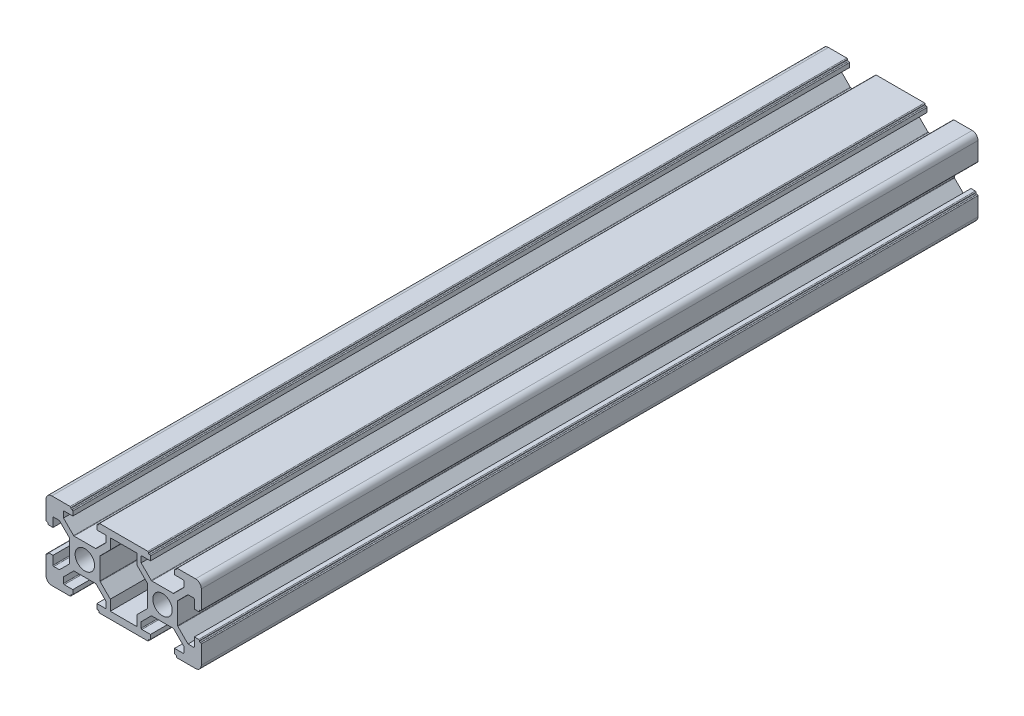
from build123d import *

# Parameters (mm, degrees)
BOSS_EXTRUDE1_DEPTH = 200
SKETCH2_R           = 2.5
CUT_EXTRUDE1_DEPTH  = 203.484567313
SKETCH3_R           = 1.5
CUT_EXTRUDE2_DEPTH  = 10
CUT_EXTRUDE3_DEPTH  = 1


with BuildPart() as part:
    # Sketch1 → Boss-Extrude1 (new body)
    with BuildSketch(Plane.XY):
        with BuildLine():
            Line((-8.5, 10), (-3.8, 10))
            ThreePointArc((-3.8, 10), (-3.658578644, 9.941421356), (-3.6, 9.8))
            Line((-3.6, 9.8), (-3.6, 9.7))
            ThreePointArc((-3.6, 9.7), (-3.541421356, 9.558578644), (-3.4, 9.5))
            Line((-3.4, 9.5), (-3.3, 9.5))
            ThreePointArc((-3.3, 9.5), (-3.158578644, 9.441421356), (-3.1, 9.3))
            Line((-3.1, 9.3), (-3.1, 8.2))
            Line((-3.1, 8.2), (-5.3, 8.2))
            ThreePointArc((-5.3, 8.2), (-5.441421356, 8.141421356), (-5.5, 8))
            Line((-5.5, 8), (-5.5, 6.560660172))
            Line((-5.5, 6.560660172), (-2.897918472, 3.958578644))
            ThreePointArc((-2.897918472, 3.958578644), (-2.833033802, 3.915224093), (-2.756497116, 3.9))
            Line((-2.756497116, 3.9), (2.756497116, 3.9))
            ThreePointArc((2.756497116, 3.9), (2.833033802, 3.915224093), (2.897918472, 3.958578644))
            Line((2.897918472, 3.958578644), (5.5, 6.560660172))
            Line((5.5, 6.560660172), (5.5, 8))
            ThreePointArc((5.5, 8), (5.441421356, 8.141421356), (5.3, 8.2))
            Line((5.3, 8.2), (3.1, 8.2))
            Line((3.1, 8.2), (3.1, 9.3))
            ThreePointArc((3.1, 9.3), (3.158578644, 9.441421356), (3.3, 9.5))
            Line((3.3, 9.5), (3.4, 9.5))
            ThreePointArc((3.4, 9.5), (3.541421356, 9.558578644), (3.6, 9.7))
            Line((3.6, 9.7), (3.6, 9.8))
            ThreePointArc((3.6, 9.8), (3.658578644, 9.941421356), (3.8, 10))
            Line((3.8, 10), (8.5, 10))
            Line((8.5, 10), (11.5, 10))
            Line((11.5, 10), (16.2, 10))
            ThreePointArc((16.2, 10), (16.341421356, 9.941421356), (16.4, 9.8))
            Line((16.4, 9.8), (16.4, 9.7))
            ThreePointArc((16.4, 9.7), (16.458578644, 9.558578644), (16.6, 9.5))
            Line((16.6, 9.5), (16.7, 9.5))
            ThreePointArc((16.7, 9.5), (16.841421356, 9.441421356), (16.9, 9.3))
            Line((16.9, 9.3), (16.9, 8.2))
            Line((16.9, 8.2), (14.7, 8.2))
            ThreePointArc((14.7, 8.2), (14.558578644, 8.141421356), (14.5, 8))
            Line((14.5, 8), (14.5, 6.560660172))
            Line((14.5, 6.560660172), (17.102081528, 3.958578644))
            ThreePointArc((17.102081528, 3.958578644), (17.166966198, 3.915224093), (17.243502884, 3.9))
            Line((17.243502884, 3.9), (22.756497116, 3.9))
            ThreePointArc((22.756497116, 3.9), (22.833033802, 3.915224093), (22.897918472, 3.958578644))
            Line((22.897918472, 3.958578644), (25.5, 6.560660172))
            Line((25.5, 6.560660172), (25.5, 8))
            ThreePointArc((25.5, 8), (25.441421356, 8.141421356), (25.3, 8.2))
            Line((25.3, 8.2), (23.1, 8.2))
            Line((23.1, 8.2), (23.1, 9.3))
            ThreePointArc((23.1, 9.3), (23.158578644, 9.441421356), (23.3, 9.5))
            Line((23.3, 9.5), (23.4, 9.5))
            ThreePointArc((23.4, 9.5), (23.541421356, 9.558578644), (23.6, 9.7))
            Line((23.6, 9.7), (23.6, 9.8))
            ThreePointArc((23.6, 9.8), (23.658578644, 9.941421356), (23.8, 10))
            Line((23.8, 10), (28.5, 10))
            ThreePointArc((28.5, 10), (29.560660172, 9.560660172), (30, 8.5))
            Line((30, 8.5), (30, 3.8))
            ThreePointArc((30, 3.8), (29.941421356, 3.658578644), (29.8, 3.6))
            Line((29.8, 3.6), (29.7, 3.6))
            ThreePointArc((29.7, 3.6), (29.558578644, 3.541421356), (29.5, 3.4))
            Line((29.5, 3.4), (29.5, 3.3))
            ThreePointArc((29.5, 3.3), (29.441421356, 3.158578644), (29.3, 3.1))
            Line((29.3, 3.1), (28.2, 3.1))
            Line((28.2, 3.1), (28.2, 5.3))
            ThreePointArc((28.2, 5.3), (28.141421356, 5.441421356), (28, 5.5))
            Line((28, 5.5), (26.560660172, 5.5))
            Line((26.560660172, 5.5), (23.958578644, 2.897918472))
            ThreePointArc((23.958578644, 2.897918472), (23.915224093, 2.833033802), (23.9, 2.756497116))
            Line((23.9, 2.756497116), (23.9, -2.756497116))
            ThreePointArc((23.9, -2.756497116), (23.915224093, -2.833033802), (23.958578644, -2.897918472))
            Line((23.958578644, -2.897918472), (26.560660172, -5.5))
            Line((26.560660172, -5.5), (28, -5.5))
            ThreePointArc((28, -5.5), (28.141421356, -5.441421356), (28.2, -5.3))
            Line((28.2, -5.3), (28.2, -3.1))
            Line((28.2, -3.1), (29.3, -3.1))
            ThreePointArc((29.3, -3.1), (29.441421356, -3.158578644), (29.5, -3.3))
            Line((29.5, -3.3), (29.5, -3.4))
            ThreePointArc((29.5, -3.4), (29.558578644, -3.541421356), (29.7, -3.6))
            Line((29.7, -3.6), (29.8, -3.6))
            ThreePointArc((29.8, -3.6), (29.941421356, -3.658578644), (30, -3.8))
            Line((30, -3.8), (30, -8.5))
            ThreePointArc((30, -8.5), (29.560660172, -9.560660172), (28.5, -10))
            Line((28.5, -10), (23.8, -10))
            ThreePointArc((23.8, -10), (23.658578644, -9.941421356), (23.6, -9.8))
            Line((23.6, -9.8), (23.6, -9.7))
            ThreePointArc((23.6, -9.7), (23.541421356, -9.558578644), (23.4, -9.5))
            Line((23.4, -9.5), (23.3, -9.5))
            ThreePointArc((23.3, -9.5), (23.158578644, -9.441421356), (23.1, -9.3))
            Line((23.1, -9.3), (23.1, -8.2))
            Line((23.1, -8.2), (25.3, -8.2))
            ThreePointArc((25.3, -8.2), (25.441421356, -8.141421356), (25.5, -8))
            Line((25.5, -8), (25.5, -6.560660172))
            Line((25.5, -6.560660172), (22.897918472, -3.958578644))
            ThreePointArc((22.897918472, -3.958578644), (22.833033802, -3.915224093), (22.756497116, -3.9))
            Line((22.756497116, -3.9), (17.243502884, -3.9))
            ThreePointArc((17.243502884, -3.9), (17.166966198, -3.915224093), (17.102081528, -3.958578644))
            Line((17.102081528, -3.958578644), (14.5, -6.560660172))
            Line((14.5, -6.560660172), (14.5, -8))
            ThreePointArc((14.5, -8), (14.558578644, -8.141421356), (14.7, -8.2))
            Line((14.7, -8.2), (16.9, -8.2))
            Line((16.9, -8.2), (16.9, -9.3))
            ThreePointArc((16.9, -9.3), (16.841421356, -9.441421356), (16.7, -9.5))
            Line((16.7, -9.5), (16.6, -9.5))
            ThreePointArc((16.6, -9.5), (16.458578644, -9.558578644), (16.4, -9.7))
            Line((16.4, -9.7), (16.4, -9.8))
            ThreePointArc((16.4, -9.8), (16.341421356, -9.941421356), (16.2, -10))
            Line((16.2, -10), (11.5, -10))
            Line((11.5, -10), (8.5, -10))
            Line((8.5, -10), (3.8, -10))
            ThreePointArc((3.8, -10), (3.658578644, -9.941421356), (3.6, -9.8))
            Line((3.6, -9.8), (3.6, -9.7))
            ThreePointArc((3.6, -9.7), (3.541421356, -9.558578644), (3.4, -9.5))
            Line((3.4, -9.5), (3.3, -9.5))
            ThreePointArc((3.3, -9.5), (3.158578644, -9.441421356), (3.1, -9.3))
            Line((3.1, -9.3), (3.1, -8.2))
            Line((3.1, -8.2), (5.3, -8.2))
            ThreePointArc((5.3, -8.2), (5.441421356, -8.141421356), (5.5, -8))
            Line((5.5, -8), (5.5, -6.560660172))
            Line((5.5, -6.560660172), (2.897918472, -3.958578644))
            ThreePointArc((2.897918472, -3.958578644), (2.833033802, -3.915224093), (2.756497116, -3.9))
            Line((2.756497116, -3.9), (-2.756497116, -3.9))
            ThreePointArc((-2.756497116, -3.9), (-2.833033802, -3.915224093), (-2.897918472, -3.958578644))
            Line((-2.897918472, -3.958578644), (-5.5, -6.560660172))
            Line((-5.5, -6.560660172), (-5.5, -8))
            ThreePointArc((-5.5, -8), (-5.441421356, -8.141421356), (-5.3, -8.2))
            Line((-5.3, -8.2), (-3.1, -8.2))
            Line((-3.1, -8.2), (-3.1, -9.3))
            ThreePointArc((-3.1, -9.3), (-3.158578644, -9.441421356), (-3.3, -9.5))
            Line((-3.3, -9.5), (-3.4, -9.5))
            ThreePointArc((-3.4, -9.5), (-3.541421356, -9.558578644), (-3.6, -9.7))
            Line((-3.6, -9.7), (-3.6, -9.8))
            ThreePointArc((-3.6, -9.8), (-3.658578644, -9.941421356), (-3.8, -10))
            Line((-3.8, -10), (-8.5, -10))
            ThreePointArc((-8.5, -10), (-9.560660172, -9.560660172), (-10, -8.5))
            Line((-10, -8.5), (-10, -3.8))
            ThreePointArc((-10, -3.8), (-9.941421356, -3.658578644), (-9.8, -3.6))
            Line((-9.8, -3.6), (-9.7, -3.6))
            ThreePointArc((-9.7, -3.6), (-9.558578644, -3.541421356), (-9.5, -3.4))
            Line((-9.5, -3.4), (-9.5, -3.3))
            ThreePointArc((-9.5, -3.3), (-9.441421356, -3.158578644), (-9.3, -3.1))
            Line((-9.3, -3.1), (-8.2, -3.1))
            Line((-8.2, -3.1), (-8.2, -5.3))
            ThreePointArc((-8.2, -5.3), (-8.141421356, -5.441421356), (-8, -5.5))
            Line((-8, -5.5), (-6.560660172, -5.5))
            Line((-6.560660172, -5.5), (-3.958578644, -2.897918472))
            ThreePointArc((-3.958578644, -2.897918472), (-3.915224093, -2.833033802), (-3.9, -2.756497116))
            Line((-3.9, -2.756497116), (-3.9, 2.756497116))
            ThreePointArc((-3.9, 2.756497116), (-3.915224093, 2.833033802), (-3.958578644, 2.897918472))
            Line((-3.958578644, 2.897918472), (-6.560660172, 5.5))
            Line((-6.560660172, 5.5), (-8, 5.5))
            ThreePointArc((-8, 5.5), (-8.141421356, 5.441421356), (-8.2, 5.3))
            Line((-8.2, 5.3), (-8.2, 3.1))
            Line((-8.2, 3.1), (-9.3, 3.1))
            ThreePointArc((-9.3, 3.1), (-9.441421356, 3.158578644), (-9.5, 3.3))
            Line((-9.5, 3.3), (-9.5, 3.4))
            ThreePointArc((-9.5, 3.4), (-9.558578644, 3.541421356), (-9.7, 3.6))
            Line((-9.7, 3.6), (-9.8, 3.6))
            ThreePointArc((-9.8, 3.6), (-9.941421356, 3.658578644), (-10, 3.8))
            Line((-10, 3.8), (-10, 8.5))
            ThreePointArc((-10, 8.5), (-9.560660172, 9.560660172), (-8.5, 10))
        make_face()
        with BuildLine():
            Line((3.9, 2.756497116), (3.9, -2.756497116))
            ThreePointArc((3.9, -2.756497116), (3.915224093, -2.833033802), (3.958578644, -2.897918472))
            Line((3.958578644, -2.897918472), (6.560660172, -5.5))
            Line((6.560660172, -5.5), (6.560660172, -8.2))
            Line((6.560660172, -8.2), (13.439339828, -8.2))
            Line((13.439339828, -8.2), (13.439339828, -5.5))
            Line((13.439339828, -5.5), (16.041421356, -2.897918472))
            ThreePointArc((16.041421356, -2.897918472), (16.084775907, -2.833033802), (16.1, -2.756497116))
            Line((16.1, -2.756497116), (16.1, 2.756497116))
            ThreePointArc((16.1, 2.756497116), (16.084775907, 2.833033802), (16.041421356, 2.897918472))
            Line((16.041421356, 2.897918472), (13.439339828, 5.5))
            Line((13.439339828, 5.5), (13.439339828, 8.2))
            Line((13.439339828, 8.2), (6.560660172, 8.2))
            Line((6.560660172, 8.2), (6.560660172, 5.5))
            Line((6.560660172, 5.5), (3.958578644, 2.897918472))
            ThreePointArc((3.958578644, 2.897918472), (3.915224093, 2.833033802), (3.9, 2.756497116))
        make_face(mode=Mode.SUBTRACT)
    extrude(amount=BOSS_EXTRUDE1_DEPTH)

    # Sketch2 → Cut-Extrude1 (cut, through all)
    with BuildSketch(Plane.XY.offset(200)):
        Circle(SKETCH2_R)
        with Locations(Location((20, 0, 0), (0, 0, 180))):
            Circle(SKETCH2_R)
    extrude(amount=-CUT_EXTRUDE1_DEPTH, mode=Mode.SUBTRACT)

    # Sketch3 → Cut-Extrude2 (cut)
    with BuildSketch(Plane.XZ.offset(3.9)):
        with Locations((20, 183.3)):
            Circle(SKETCH3_R)
        with Locations((20, 166.6)):
            Circle(SKETCH3_R)
        with Locations((0, 166.6)):
            Circle(SKETCH3_R)
        with Locations((0, 183.3)):
            Circle(SKETCH3_R)
    extrude(amount=-CUT_EXTRUDE2_DEPTH, mode=Mode.SUBTRACT)

    # Sketch4 → Cut-Extrude3 (cut)
    # profile 1 of 7: a face of its own
    with BuildSketch(Plane.XZ.offset(10)):
        with BuildLine():
            Line((5.405689325, 199.018538248), (4.398870658, 198.515128915))
            add(Edge.make_bspline(
                [(4.398870658, 198.515128915), (4.375470361, 198.504007187), (4.332287922, 198.483483372), (4.272890674, 198.454114045), (4.223964892, 198.429334287), (4.175163438, 198.401811983), (4.124432953, 198.37568004), (4.075408852, 198.36254351), (4.043274946, 198.358682258), (4.026000646, 198.35704289), (4.015934415, 198.356490843), (4.007102707, 198.357946256), (4.009027033, 198.366735391), (4.010780376, 198.371430848), (4.011804816, 198.374174302)],
                knots=[0, 0, 0, 0, 2.113482073, 3.900177315, 5.405807338, 6.585701353, 8.47248579, 10.046621559, 10.680507243, 11.128502661, 11.432699657, 11.560960372, 11.74347857, 12, 12, 12, 12], degree=3))
            add(Edge.make_bspline(
                [(4.011804816, 198.374174302), (4.012253079, 198.380189599), (4.013076615, 198.391240727), (4.019572333, 198.409113814), (4.036067403, 198.42879124), (4.04867769, 198.444752576), (4.056552312, 198.454719795)],
                knots=[0, 0, 0, 0, 0.76500436, 1.405443559, 2.379802743, 4, 4, 4, 4], degree=3))
            Line((4.056552312, 198.454719795), (4.142318346, 198.570317494))
            add(Edge.make_bspline(
                [(4.142318346, 198.570317494), (4.15329164, 198.586113956), (4.172345099, 198.613542117), (4.199206632, 198.647089641), (4.215949289, 198.669007008), (4.229005362, 198.681559753), (4.24333129, 198.683175519), (4.261250243, 198.685834774), (4.287282369, 198.686727747), (4.320596735, 198.688042176), (4.360200719, 198.691165548), (4.404361497, 198.700587741), (4.452258254, 198.715172829), (4.520188989, 198.739676534), (4.602153471, 198.774120727), (4.666179305, 198.803356193), (4.696441509, 198.817174515)],
                knots=[0, 0, 0, 0, 1.27946367, 2.221594617, 2.843686471, 3.137924783, 3.374542097, 3.774254406, 4.353610435, 5.098017717, 5.994242814, 6.989243992, 8.092537102, 9.32092557, 11.788406741, 14, 14, 14, 14], degree=3))
            Line((4.696441509, 198.817174515), (5.240123588, 199.093863201))
            Line((5.240123588, 199.093863201), (4.328766248, 199.536863414))
            Line((4.328766248, 199.536863414), (4.112486682, 199.647240571))
            add(Edge.make_bspline(
                [(4.112486682, 199.647240571), (4.097898348, 199.655501066), (4.070009846, 199.671292643), (4.038919052, 199.692667929), (4.017120497, 199.707598639), (4.009217413, 199.71634861), (4.002107957, 199.723193104), (4.008116126, 199.731210193), (4.021424767, 199.73363871), (4.036512774, 199.740512061), (4.054434497, 199.744047682), (4.074177091, 199.745236018), (4.099084921, 199.745155522), (4.117462818, 199.744047151), (4.127402514, 199.743447688)],
                knots=[0, 0, 0, 0, 2.288612866, 4.375138456, 5.226165039, 5.803861041, 6.12500379, 6.323495593, 6.994026778, 7.930620101, 8.591577993, 9.479260322, 10.636656475, 12, 12, 12, 12], degree=3))
            Line((4.127402514, 199.743447688), (4.257916045, 199.733006606))
            Line((4.257916045, 199.733006606), (4.434668655, 199.718090773))
            add(Edge.make_bspline(
                [(4.434668655, 199.718090773), (4.442798302, 199.717743015), (4.455997342, 199.717178404), (4.472512014, 199.715086219), (4.481778019, 199.706808802), (4.486840316, 199.694517903), (4.494639887, 199.677910897), (4.50171184, 199.655674874), (4.513291828, 199.630467306), (4.533667941, 199.606610137), (4.558240915, 199.581083988), (4.603682973, 199.549072968), (4.671125734, 199.508908743), (4.729979723, 199.480920017), (4.761325378, 199.466013211)],
                knots=[0, 0, 0, 0, 0.684866172, 1.111927356, 1.332136251, 1.684299924, 2.203842278, 2.865766853, 3.625492481, 4.495790489, 5.462563622, 6.5729227, 9.109536716, 12, 12, 12, 12], degree=3))
            Line((4.761325378, 199.466013211), (5.381078202, 199.179629235))
            Line((5.381078202, 199.179629235), (6.025442148, 199.481674835))
            add(Edge.make_bspline(
                [(6.025442148, 199.481674835), (6.05530856, 199.496272179), (6.108947914, 199.522488657), (6.180320583, 199.558497987), (6.233692898, 199.586302366), (6.281250563, 199.613305969), (6.327826598, 199.644610778), (6.375662216, 199.683450324), (6.41605415, 199.717956353), (6.439153764, 199.73941885), (6.448305988, 199.747922438)],
                knots=[0, 0, 0, 0, 1.58777371, 2.851603225, 3.818285944, 4.461889746, 5.463034698, 6.494081497, 7.403344846, 8, 8, 8, 8], degree=3))
            Line((6.448305988, 199.747922438), (6.488578734, 199.793415726))
            Line((6.488578734, 199.793415726), (6.548987854, 199.768058811))
            Line((6.548987854, 199.768058811), (6.468442361, 199.476454294))
            add(Edge.make_bspline(
                [(6.468442361, 199.476454294), (6.454765304, 199.476160185), (6.430330339, 199.475634742), (6.396247104, 199.472183634), (6.36632575, 199.464467027), (6.33957438, 199.45683859), (6.310871469, 199.44563242), (6.275913336, 199.430777178), (6.228102187, 199.407721606), (6.191526816, 199.390639686), (6.170871511, 199.380992968)],
                knots=[0, 0, 0, 0, 1.039349584, 1.856866603, 2.594340973, 3.382992685, 3.968725486, 4.933329466, 6.268151062, 8, 8, 8, 8], degree=3))
            Line((6.170871511, 199.380992968), (5.546643938, 199.099083742))
            Line((5.546643938, 199.099083742), (6.201448967, 198.781376518))
            add(Edge.make_bspline(
                [(6.201448967, 198.781376518), (6.216388546, 198.77446763), (6.244045917, 198.761677332), (6.281972644, 198.743244362), (6.314469997, 198.72952267), (6.35069139, 198.712203074), (6.399600412, 198.694102045), (6.46236425, 198.676183856), (6.52343932, 198.660223428), (6.562369955, 198.653643316), (6.578819518, 198.650862987)],
                knots=[0, 0, 0, 0, 0.985086527, 1.823672732, 2.523088216, 3.095642457, 4.225768838, 5.637986055, 7.001965939, 8, 8, 8, 8], degree=3))
            Line((6.578819518, 198.650862987), (6.664585553, 198.645642446))
            Line((6.664585553, 198.645642446), (6.674280844, 198.590453867))
            Line((6.674280844, 198.590453867), (6.241721713, 198.504687833))
            add(Edge.make_bspline(
                [(6.241721713, 198.504687833), (6.23823433, 198.514371131), (6.231574374, 198.532863604), (6.221091921, 198.562518515), (6.198785569, 198.594606518), (6.15959203, 198.630369869), (6.100961347, 198.670859724), (6.052495107, 198.693444925), (6.025442148, 198.706051566)],
                knots=[0, 0, 0, 0, 0.60425042, 1.153954364, 1.837467463, 2.868811726, 4.252228599, 6, 6, 6, 6], degree=3))
            Line((6.025442148, 198.706051566), (5.405689325, 199.018538248))
        make_face()
    # profile 2 of 7: a face of its own
    with BuildSketch(Plane.XZ.offset(10)):
        with BuildLine():
            add(Edge.make_bspline(
                [(4.4040912, 196.055508204), (4.384216489, 196.057882732), (4.346997055, 196.062329519), (4.294245342, 196.066571171), (4.248510275, 196.070056996), (4.198756615, 196.070466993), (4.146956296, 196.071176363), (4.102335148, 196.077261002), (4.07415018, 196.084260026), (4.062177042, 196.090169095), (4.053422268, 196.097553171), (4.055523495, 196.102872), (4.056552312, 196.105476241)],
                knots=[0, 0, 0, 0, 1.654098457, 3.097635461, 4.374174197, 5.442795876, 7.210879807, 8.643407929, 9.176829156, 9.572051243, 9.790464788, 10, 10, 10, 10], degree=3))
            add(Edge.make_bspline(
                [(4.056552312, 196.105476241), (4.057302367, 196.106466384), (4.060512786, 196.110704437), (4.06738508, 196.121029708), (4.086100252, 196.132617716), (4.102626873, 196.137572447), (4.112486682, 196.140528447)],
                knots=[0, 0, 0, 0, 0.220129113, 0.942206293, 2.175715252, 4, 4, 4, 4], degree=3))
            Line((4.112486682, 196.140528447), (4.177370552, 196.165885361))
            Line((4.177370552, 196.165885361), (4.389175368, 196.236735564))
            add(Edge.make_bspline(
                [(4.389175368, 196.236735564), (4.400593788, 196.240264982), (4.42111392, 196.246607727), (4.448372499, 196.254339678), (4.468818525, 196.258367632), (4.48834553, 196.259969011), (4.511832299, 196.253553249), (4.542612438, 196.23943904), (4.583441094, 196.225051471), (4.631568032, 196.210577435), (4.68327943, 196.198619484), (4.730132299, 196.19331978), (4.775985927, 196.191755609), (4.82770538, 196.190416568), (4.897049566, 196.187912278), (4.949262909, 196.186698131), (4.978350735, 196.186021734)],
                knots=[0, 0, 0, 0, 0.834378348, 1.499467721, 1.97595881, 2.288790536, 2.857210041, 3.64346534, 4.659010869, 5.872341409, 7.15221937, 8.357582129, 9.156564213, 10.354409044, 11.969057202, 14, 14, 14, 14], degree=3))
            Line((4.978350735, 196.186021734), (6.780183252, 196.180801193))
            add(Edge.make_bspline(
                [(6.780183252, 196.180801193), (6.818222881, 196.18131292), (6.889617281, 196.18227335), (6.991667487, 196.187184874), (7.085337941, 196.196849738), (7.159150604, 196.205877921), (7.21351823, 196.21391693), (7.246757316, 196.219371267), (7.272939198, 196.222822902), (7.28782293, 196.225272362), (7.294033667, 196.226294481)],
                knots=[0, 0, 0, 0, 1.76776236, 3.317811778, 4.745426959, 6.142428608, 6.773033178, 7.299115075, 7.707532242, 8, 8, 8, 8], degree=3))
            Line((7.294033667, 196.226294481), (7.37457916, 196.251651396))
            Line((7.37457916, 196.251651396), (7.424547198, 196.206158108))
            Line((7.424547198, 196.206158108), (7.122501598, 195.984658001))
            add(Edge.make_bspline(
                [(7.122501598, 195.984658001), (7.106792042, 195.989229505), (7.077266637, 195.99782144), (7.033452602, 196.013224174), (6.984523316, 196.025992372), (6.936000478, 196.034049936), (6.886662293, 196.039643793), (6.837930845, 196.043603894), (6.779437464, 196.044388221), (6.737174157, 196.044830435), (6.71455359, 196.045067121)],
                knots=[0, 0, 0, 0, 0.945941833, 1.777855114, 2.684418718, 3.866092074, 4.618573467, 5.555736068, 6.691757972, 8, 8, 8, 8], degree=3))
            Line((6.71455359, 196.045067121), (6.216364799, 196.045067121))
            add(Edge.make_bspline(
                [(6.216364799, 196.045067121), (6.228047757, 196.037609047), (6.254259347, 196.020876302), (6.289042842, 195.998688844), (6.320976338, 195.975618313), (6.348604695, 195.952674831), (6.377479106, 195.922979912), (6.408333712, 195.889182808), (6.437297735, 195.850312154), (6.461247121, 195.8068071), (6.475675563, 195.75840432), (6.48077237, 195.724944754), (6.483358193, 195.707969316)],
                knots=[0, 0, 0, 0, 0.929261729, 2.08486808, 2.76490863, 3.569370846, 4.488565088, 5.539043116, 6.635702196, 7.731727918, 8.849210703, 10, 10, 10, 10], degree=3))
            add(Edge.make_bspline(
                [(6.483358193, 195.707969316), (6.483964034, 195.688015301), (6.485181789, 195.647907207), (6.471304761, 195.58822165), (6.447253188, 195.529747137), (6.410907536, 195.47473936), (6.367396125, 195.42283613), (6.316720744, 195.376415158), (6.26088689, 195.334858228), (6.179001435, 195.290881849), (6.073882122, 195.247537053), (5.965381294, 195.217027418), (5.875415184, 195.201792714), (5.801403839, 195.190174151), (5.719439106, 195.181234907), (5.597383633, 195.167332262), (5.430748371, 195.155830796), (5.221289507, 195.150200009), (5.007488261, 195.152761624), (4.866170443, 195.167017291), (4.797123375, 195.173982527)],
                knots=[0, 0, 0, 0, 0.551888208, 1.109309806, 1.68450244, 2.298740058, 2.930242627, 3.559934216, 4.201491226, 4.856080764, 6.133284784, 7.349947576, 7.973717169, 8.664419706, 9.428487307, 10.26109817, 12.073136923, 14.060545576, 16.075205358, 18, 18, 18, 18], degree=3))
            add(Edge.make_bspline(
                [(4.797123375, 195.173982527), (4.761986631, 195.178984069), (4.694881383, 195.188536169), (4.60037292, 195.20948379), (4.515498917, 195.230096306), (4.44151369, 195.255446532), (4.37769018, 195.283645258), (4.321740428, 195.311466111), (4.274856394, 195.341936662), (4.224349131, 195.382958325), (4.176465257, 195.440651833), (4.138135764, 195.515591842), (4.11810568, 195.590558136), (4.117326779, 195.639513353), (4.116961432, 195.662476028)],
                knots=[0, 0, 0, 0, 1.381403856, 2.638248161, 3.767543458, 4.780811365, 5.678190839, 6.483442268, 7.211059005, 7.850603229, 9.01192915, 10.098557327, 11.108119387, 12, 12, 12, 12], degree=3))
            add(Edge.make_bspline(
                [(4.116961432, 195.662476028), (4.117550152, 195.677931043), (4.11874658, 195.709339527), (4.128320999, 195.756864877), (4.143438425, 195.805528076), (4.163661188, 195.854218467), (4.188748987, 195.900034866), (4.219657322, 195.938439058), (4.254147685, 195.96954379), (4.280694683, 195.983187367), (4.293714042, 195.989878543)],
                knots=[0, 0, 0, 0, 0.950081545, 1.930805051, 2.970780528, 4.081223131, 5.169973651, 6.170642917, 7.102834297, 8, 8, 8, 8], degree=3))
            Line((4.293714042, 195.989878543), (4.4040912, 196.055508204))
        make_face()
        with BuildLine():
            add(Edge.make_bspline(
                [(5.038759855, 196.050287662), (4.996489995, 196.050170535), (4.918114097, 196.049953358), (4.808063687, 196.044137844), (4.710382826, 196.033428906), (4.619244126, 196.014029216), (4.528765897, 195.981896212), (4.455821479, 195.941737622), (4.399915368, 195.903584685), (4.362778465, 195.87307867), (4.334739688, 195.839120558), (4.312308428, 195.80453357), (4.297151469, 195.767851029), (4.288136202, 195.729329635), (4.285221381, 195.688814329), (4.287390121, 195.661471352), (4.288493501, 195.647560196)],
                knots=[0, 0, 0, 0, 1.845917827, 3.422662539, 4.811160948, 6.133693706, 7.483401613, 8.989439591, 9.754418173, 10.439823622, 11.079316246, 11.669733515, 12.234328133, 12.803187042, 13.391103168, 14, 14, 14, 14], degree=3))
            add(Edge.make_bspline(
                [(4.288493501, 195.647560196), (4.290354556, 195.626207407), (4.2941286, 195.582905982), (4.316584073, 195.531205596), (4.345632005, 195.493106041), (4.376928656, 195.465114941), (4.416049909, 195.436921812), (4.462647001, 195.408606766), (4.516617039, 195.383364261), (4.575703602, 195.359766128), (4.640351925, 195.341034855), (4.70957892, 195.323378949), (4.784436077, 195.310501049), (4.864256458, 195.29974057), (4.9494463, 195.293656393), (5.067020119, 195.287639499), (5.209798048, 195.286745046), (5.322412195, 195.285633164), (5.37585766, 195.285105476)],
                knots=[0, 0, 0, 0, 0.824770147, 1.672555393, 2.131829284, 2.668927445, 3.287724202, 3.994607415, 4.772432371, 5.587803282, 6.451018784, 7.371474039, 8.34770517, 9.384513317, 10.483222405, 11.647207185, 13.934211268, 16, 16, 16, 16], degree=3))
            add(Edge.make_bspline(
                [(5.37585766, 195.285105476), (5.410428201, 195.286051306), (5.476643523, 195.287862919), (5.571080534, 195.295129802), (5.65652885, 195.30259933), (5.758901765, 195.317846967), (5.88150771, 195.344710789), (6.000529405, 195.380331502), (6.09050177, 195.414900482), (6.148762582, 195.444449087), (6.196192372, 195.478002456), (6.233709127, 195.514486432), (6.261980346, 195.552678634), (6.283074623, 195.590774652), (6.297676168, 195.628938663), (6.300660355, 195.654902643), (6.302130833, 195.667696569)],
                knots=[0, 0, 0, 0, 1.349924509, 2.585602747, 3.697158241, 4.69775731, 6.624226206, 8.59222397, 9.542016248, 10.384152841, 11.135554691, 11.801277911, 12.418545044, 12.98321311, 13.498971423, 14, 14, 14, 14], degree=3))
            add(Edge.make_bspline(
                [(6.302130833, 195.667696569), (6.301082134, 195.685691704), (6.299005892, 195.721318959), (6.283696158, 195.773059133), (6.257243765, 195.82089), (6.222587248, 195.864844758), (6.182090825, 195.902873179), (6.140633324, 195.93672926), (6.097876578, 195.963538486), (6.052445941, 195.983562353), (6.003597223, 195.999205546), (5.948536662, 196.012713142), (5.886163221, 196.023420597), (5.819423238, 196.032378654), (5.754830334, 196.040685474), (5.697799873, 196.045318854), (5.651625642, 196.050004356), (5.624214458, 196.050201697), (5.612273599, 196.050287662)],
                knots=[0, 0, 0, 0, 0.989563793, 1.959165217, 2.938464336, 3.98106769, 5.025912143, 5.98941508, 6.923231245, 7.792710274, 8.714120056, 9.742628643, 10.90987881, 12.194436095, 13.448327045, 14.492365256, 15.343244234, 16, 16, 16, 16], degree=3))
            Line((5.612273599, 196.050287662), (5.038759855, 196.050287662))
        make_face(mode=Mode.SUBTRACT)
    # profile 3 of 7: a face of its own
    with BuildSketch(Plane.XZ.offset(10)):
        with BuildLine():
            add(Edge.make_bspline(
                [(5.335584914, 194.842105263), (5.377366057, 194.840418465), (5.458529526, 194.837141715), (5.57645225, 194.827391018), (5.686684816, 194.8141199), (5.78912589, 194.797402146), (5.883427148, 194.775593197), (5.969943433, 194.75050458), (6.048975081, 194.72165618), (6.119555611, 194.687913112), (6.182627318, 194.652244891), (6.240094134, 194.61912074), (6.291103808, 194.586814552), (6.33601044, 194.5562056), (6.373328973, 194.524841356), (6.405823853, 194.496369086), (6.431438063, 194.468119809), (6.455776323, 194.432529869), (6.477947949, 194.390332241), (6.497903836, 194.341965), (6.510831595, 194.296611844), (6.512434409, 194.266923025), (6.513189857, 194.252929896)],
                knots=[0, 0, 0, 0, 1.764634521, 3.427954541, 4.992196183, 6.449700333, 7.806241009, 9.074501551, 10.249686689, 11.352583265, 12.371647559, 13.307368702, 14.151493099, 14.919911991, 15.598324322, 16.207396272, 16.742379693, 17.202230901, 18.023686107, 18.748462212, 19.410116977, 20, 20, 20, 20], degree=3))
            add(Edge.make_bspline(
                [(6.513189857, 194.252929896), (6.511371977, 194.238925455), (6.507567459, 194.209616521), (6.492810291, 194.164919625), (6.468643594, 194.118694417), (6.443702107, 194.077981042), (6.416244857, 194.044452643), (6.388459568, 194.018053239), (6.354599811, 193.989972738), (6.313254059, 193.96239625), (6.266249607, 193.93196671), (6.211850899, 193.902036777), (6.151241729, 193.870573095), (6.08426293, 193.838264483), (6.009987736, 193.807370315), (5.927571487, 193.781583707), (5.837623981, 193.759954468), (5.739947984, 193.743104382), (5.634646232, 193.730471271), (5.521642655, 193.722757298), (5.401005485, 193.717717617), (5.317938786, 193.719018962), (5.275175794, 193.719688898)],
                knots=[0, 0, 0, 0, 0.583563041, 1.221299034, 1.934495109, 2.739387755, 3.192559802, 3.723702059, 4.323104031, 5.010912353, 5.778717214, 6.640149723, 7.578909276, 8.605156425, 9.717149955, 10.904820149, 12.175010999, 13.543452273, 15.004670893, 16.562387688, 18.230306584, 20, 20, 20, 20], degree=3))
            add(Edge.make_bspline(
                [(5.275175794, 193.719688898), (5.231653366, 193.721361465), (5.147506608, 193.724595224), (5.025870942, 193.734419044), (4.91279889, 193.74737292), (4.808339843, 193.765503037), (4.712204204, 193.786366541), (4.625135079, 193.812830797), (4.546423431, 193.842300533), (4.476310842, 193.87617005), (4.413870699, 193.911471797), (4.357944928, 193.945638802), (4.308557003, 193.978644257), (4.264897868, 194.009775065), (4.227710975, 194.040376834), (4.19622224, 194.069161628), (4.171083553, 194.096632697), (4.147618861, 194.131444385), (4.126380817, 194.173338914), (4.108514582, 194.221942174), (4.096433502, 194.268249271), (4.096697106, 194.298604622), (4.096825059, 194.313339016)],
                knots=[0, 0, 0, 0, 1.8254638, 3.529372482, 5.113983704, 6.594112102, 7.971884292, 9.234466531, 10.405306527, 11.491273865, 12.494282261, 13.411094474, 14.237657955, 14.98385902, 15.657644954, 16.254885857, 16.771507737, 17.213728076, 18.010662647, 18.732680123, 19.384846856, 20, 20, 20, 20], degree=3))
            add(Edge.make_bspline(
                [(4.096825059, 194.313339016), (4.097670995, 194.328122586), (4.099428288, 194.358832998), (4.115347976, 194.404793167), (4.137645866, 194.452912943), (4.1639954, 194.493660027), (4.192372861, 194.52696685), (4.220656401, 194.553739763), (4.256500029, 194.58027675), (4.297864911, 194.608883887), (4.346907306, 194.636477814), (4.401178795, 194.667144418), (4.463589072, 194.696048557), (4.531366438, 194.728092817), (4.60697521, 194.757171264), (4.689689546, 194.782375361), (4.779873432, 194.803361901), (4.877118822, 194.819103453), (4.981564992, 194.832146151), (5.09308431, 194.839950287), (5.212008087, 194.843821819), (5.293570229, 194.842688872), (5.335584914, 194.842105263)],
                knots=[0, 0, 0, 0, 0.609092621, 1.265288736, 1.99124151, 2.800277882, 3.259249877, 3.796866187, 4.404918809, 5.099990968, 5.873295192, 6.728228889, 7.674521439, 8.713227137, 9.825209791, 11.01753237, 12.283114261, 13.647408312, 15.085663506, 16.630395189, 18.264232863, 20, 20, 20, 20], degree=3))
        make_face()
        with BuildLine():
            add(Edge.make_bspline(
                [(5.325143831, 194.695930109), (5.289348037, 194.696966784), (5.219997284, 194.698975239), (5.119012169, 194.697130871), (5.024443958, 194.693107354), (4.936331797, 194.684939597), (4.854849608, 194.673301112), (4.780017412, 194.657334744), (4.711195444, 194.639389433), (4.632234881, 194.610017807), (4.547807997, 194.573005578), (4.462794234, 194.529686885), (4.399095123, 194.488712035), (4.354826322, 194.448744935), (4.328447389, 194.408895708), (4.30818295, 194.37348788), (4.296082621, 194.338216425), (4.294485913, 194.314910251), (4.293714042, 194.303643725)],
                knots=[0, 0, 0, 0, 1.450292897, 2.809796688, 4.090023312, 5.283351425, 6.392665891, 7.421558502, 8.381527156, 9.270195791, 10.830384, 12.113972103, 13.130522017, 13.892668432, 14.507225389, 15.056901841, 15.544093346, 16, 16, 16, 16], degree=3))
            add(Edge.make_bspline(
                [(4.293714042, 194.303643725), (4.293390915, 194.293131286), (4.292717008, 194.27120682), (4.303459684, 194.237975179), (4.31820448, 194.20230092), (4.342121676, 194.163256205), (4.382276487, 194.122176196), (4.441577156, 194.078898297), (4.521562662, 194.031994847), (4.60074827, 193.989602726), (4.6760854, 193.956828378), (4.742217989, 193.934574463), (4.815268602, 193.915431902), (4.895205342, 193.899126211), (4.982075185, 193.885848197), (5.075852711, 193.875257562), (5.176922692, 193.869268942), (5.28282794, 193.864170669), (5.390310175, 193.864601946), (5.495316329, 193.867933932), (5.59613567, 193.876048731), (5.692389827, 193.888905256), (5.78435939, 193.904962609), (5.871983179, 193.926011871), (5.955462812, 193.951062147), (6.008896753, 193.9714497), (6.035137439, 193.981461752)],
                knots=[0, 0, 0, 0, 0.390008479, 0.813391427, 1.287566515, 1.833704639, 2.510111583, 3.418024472, 4.567503627, 5.970969343, 6.769385843, 7.632481783, 8.573717181, 9.587807216, 10.677555774, 11.854447898, 13.110473302, 14.457701576, 15.81306122, 17.122827165, 18.380224076, 19.588121829, 20.7480868, 21.864901124, 22.951481802, 24, 24, 24, 24], degree=3))
            add(Edge.make_bspline(
                [(6.035137439, 193.981461752), (6.059951679, 193.992745247), (6.106166627, 194.013760041), (6.167599549, 194.048840074), (6.21705344, 194.083135218), (6.253203202, 194.119478829), (6.279623355, 194.154727614), (6.298345559, 194.188809468), (6.312114148, 194.220927758), (6.315459061, 194.242629533), (6.317046665, 194.252929896)],
                knots=[0, 0, 0, 0, 1.597305255, 2.974879719, 4.143993945, 5.112783108, 5.966898527, 6.717206142, 7.391144642, 8, 8, 8, 8], degree=3))
            add(Edge.make_bspline(
                [(6.317046665, 194.252929896), (6.316543662, 194.264198373), (6.315494641, 194.287698957), (6.303780753, 194.322925045), (6.287252276, 194.359731773), (6.263392983, 194.400111199), (6.223820011, 194.442660345), (6.163712074, 194.485932645), (6.083227107, 194.53299751), (6.002999787, 194.574440555), (5.926848239, 194.606424768), (5.860892636, 194.628700677), (5.787681129, 194.646946811), (5.708414867, 194.663550828), (5.621950851, 194.675988425), (5.529106369, 194.685204923), (5.429429684, 194.693282728), (5.360710471, 194.695027221), (5.325143831, 194.695930109)],
                knots=[0, 0, 0, 0, 0.462097373, 0.963711245, 1.513106502, 2.123568951, 2.883856956, 3.884212733, 5.159498054, 6.719369627, 7.595087039, 8.555749695, 9.580337177, 10.697680962, 11.886741469, 13.17219998, 14.536430512, 16, 16, 16, 16], degree=3))
        make_face(mode=Mode.SUBTRACT)
    # profile 4 of 7: a face of its own
    with BuildSketch(Plane.XZ.offset(10)):
        with BuildLine():
            add(Edge.make_bspline(
                [(6.362539953, 192.838909013), (6.362732716, 192.834687736), (6.363074363, 192.827206079), (6.364534932, 192.814536892), (6.373489968, 192.797634309), (6.378985614, 192.783064204), (6.382676326, 192.773279352)],
                knots=[0, 0, 0, 0, 0.732822287, 1.298830485, 2.185974516, 4, 4, 4, 4], degree=3))
            Line((6.382676326, 192.773279352), (6.412507991, 192.677818027))
            add(Edge.make_bspline(
                [(6.412507991, 192.677818027), (6.416352702, 192.665341973), (6.424509014, 192.638874817), (6.439294867, 192.600470612), (6.45496111, 192.565478921), (6.467518695, 192.545466577), (6.472917111, 192.536863414)],
                knots=[0, 0, 0, 0, 1.017807471, 2.159213881, 3.208659257, 4, 4, 4, 4], degree=3))
            Line((6.472917111, 192.536863414), (6.503494566, 192.491370126))
            Line((6.503494566, 192.491370126), (6.362539953, 192.345940763))
            add(Edge.make_bspline(
                [(6.362539953, 192.345940763), (6.355174689, 192.340464204), (6.342240785, 192.330846997), (6.320881021, 192.32427767), (6.303926614, 192.327896532), (6.287961989, 192.331775174), (6.276965607, 192.348749912), (6.276845218, 192.362442555), (6.276773919, 192.370551886)],
                knots=[0, 0, 0, 0, 1.377425141, 2.418851921, 3.210888427, 3.966904226, 4.795919252, 6, 6, 6, 6], degree=3))
            Line((6.276773919, 192.370551886), (6.267078628, 192.446622629))
            add(Edge.make_bspline(
                [(6.267078628, 192.446622629), (6.263124374, 192.4689997), (6.254766943, 192.516294292), (6.240947656, 192.591609771), (6.221604389, 192.674593896), (6.208375932, 192.733000143), (6.201448967, 192.763584061)],
                knots=[0, 0, 0, 0, 0.842298951, 1.780223452, 2.837633525, 4, 4, 4, 4], degree=3))
            Line((6.201448967, 192.763584061), (6.186533134, 192.838909013))
            Line((6.186533134, 192.838909013), (4.726273173, 192.838909013))
            add(Edge.make_bspline(
                [(4.726273173, 192.838909013), (4.690467849, 192.838415064), (4.626021288, 192.837525997), (4.540047848, 192.833069767), (4.475303461, 192.824689272), (4.419744235, 192.807982732), (4.372624426, 192.778886107), (4.337623065, 192.744346762), (4.319193859, 192.71242219), (4.313253363, 192.685083116), (4.309497151, 192.654946704), (4.312343999, 192.63381261), (4.313850416, 192.622629448)],
                knots=[0, 0, 0, 0, 1.991945531, 3.585333911, 4.788221947, 5.614901597, 6.793697312, 7.830482769, 8.319445486, 8.819240969, 9.375198244, 10, 10, 10, 10], degree=3))
            add(Edge.make_bspline(
                [(4.313850416, 192.622629448), (4.315183999, 192.611616349), (4.317757878, 192.590360551), (4.32804376, 192.560851848), (4.344505567, 192.536142192), (4.366034506, 192.514778403), (4.396246611, 192.499278796), (4.433913498, 192.486765932), (4.48034825, 192.478273516), (4.535527812, 192.473672851), (4.600245633, 192.470445545), (4.675040221, 192.465619141), (4.760340539, 192.461465687), (4.820493737, 192.45809883), (4.852311954, 192.45631792)],
                knots=[0, 0, 0, 0, 0.647618369, 1.249933885, 1.806296213, 2.37169955, 3.002794319, 3.770444153, 4.688388767, 5.75436937, 7.006559047, 8.477262984, 10.136637587, 12, 12, 12, 12], degree=3))
            Line((4.852311954, 192.45631792), (5.154357554, 192.446622629))
            Line((5.154357554, 192.446622629), (5.154357554, 192.380992968))
            Line((5.154357554, 192.380992968), (4.857532495, 192.380992968))
            add(Edge.make_bspline(
                [(4.857532495, 192.380992968), (4.81850246, 192.380999943), (4.746657364, 192.381012781), (4.647967412, 192.380933025), (4.567661736, 192.381156276), (4.48582972, 192.380410107), (4.397097729, 192.384838885), (4.314993425, 192.40261664), (4.254079314, 192.422332011), (4.215720167, 192.443814311), (4.18282017, 192.468480368), (4.156202112, 192.497926111), (4.136296884, 192.532229151), (4.124240605, 192.57098856), (4.116066529, 192.613090299), (4.116656257, 192.642475371), (4.116961432, 192.657681654)],
                knots=[0, 0, 0, 0, 1.823749578, 3.357093172, 4.611647022, 5.575794888, 7.182241415, 8.749702164, 9.48813326, 10.163974811, 10.79361356, 11.402331104, 12.006040373, 12.630514535, 13.291314191, 14, 14, 14, 14], degree=3))
            add(Edge.make_bspline(
                [(4.116961432, 192.657681654), (4.117592532, 192.676879296), (4.118785182, 192.713158921), (4.129959529, 192.76461964), (4.149573957, 192.809019803), (4.176177772, 192.847827096), (4.212013305, 192.879803289), (4.255915441, 192.90642323), (4.307816838, 192.928894518), (4.368424978, 192.945494245), (4.437253017, 192.958732915), (4.514482155, 192.968316155), (4.600174639, 192.973090338), (4.659892758, 192.974108799), (4.691220967, 192.974643085)],
                knots=[0, 0, 0, 0, 0.926718426, 1.751308632, 2.525651666, 3.258655965, 4.006755261, 4.826608924, 5.730237509, 6.729958161, 7.855828576, 9.114589967, 10.486309822, 12, 12, 12, 12], degree=3))
            Line((4.691220967, 192.974643085), (6.155955679, 192.979863627))
            Line((6.155955679, 192.979863627), (6.095546559, 193.272213936))
            add(Edge.make_bspline(
                [(6.095546559, 193.272213936), (6.108353798, 193.287980886), (6.132593198, 193.317821932), (6.169008619, 193.358776956), (6.205856187, 193.392881179), (6.246023874, 193.412136448), (6.276757527, 193.422138798), (6.300175012, 193.425754785), (6.31173075, 193.415078913), (6.315156274, 193.407119762), (6.317046665, 193.402727466)],
                knots=[0, 0, 0, 0, 1.679063987, 3.177851322, 4.533357148, 5.801920529, 6.790247391, 7.283555128, 7.60462651, 8, 8, 8, 8], degree=3))
            Line((6.317046665, 193.402727466), (6.307351374, 193.327402514))
            Line((6.307351374, 193.327402514), (6.307351374, 193.256552312))
            add(Edge.make_bspline(
                [(6.307351374, 193.256552312), (6.307292585, 193.237396179), (6.307181831, 193.201307914), (6.304197774, 193.151000305), (6.303154136, 193.107704357), (6.309147594, 193.082233402), (6.311826124, 193.070850202)],
                knots=[0, 0, 0, 0, 1.23233348, 2.321594721, 3.24990559, 4, 4, 4, 4], degree=3))
            Line((6.311826124, 193.070850202), (6.331962497, 192.974643085))
            Line((6.331962497, 192.974643085), (6.719774132, 192.974643085))
            add(Edge.make_bspline(
                [(6.719774132, 192.974643085), (6.757813929, 192.975153652), (6.829208643, 192.976111905), (6.931256767, 192.981037849), (7.024934269, 192.990653903), (7.098970266, 192.999856174), (7.153618126, 193.007676026), (7.187573844, 193.013341445), (7.214999152, 193.016766499), (7.231141501, 193.019121362), (7.238099297, 193.020136373)],
                knots=[0, 0, 0, 0, 1.752737237, 3.289611987, 4.705093132, 6.090220945, 6.726797833, 7.248408289, 7.676043345, 8, 8, 8, 8], degree=3))
            Line((7.238099297, 193.020136373), (7.31864479, 193.045493288))
            Line((7.31864479, 193.045493288), (7.369358619, 193))
            Line((7.369358619, 193), (7.067313019, 192.778499893))
            add(Edge.make_bspline(
                [(7.067313019, 192.778499893), (7.050500315, 192.784750455), (7.019884406, 192.796132718), (6.97356046, 192.808701262), (6.924982881, 192.820314453), (6.883502312, 192.827081512), (6.847592407, 192.831123165), (6.819474471, 192.833139359), (6.783694209, 192.83553942), (6.739919539, 192.836902521), (6.688202444, 192.837419303), (6.628539438, 192.83818421), (6.561171648, 192.839126187), (6.513687449, 192.83898413), (6.488578734, 192.838909013)],
                knots=[0, 0, 0, 0, 1.1017451, 2.006276124, 2.94760755, 4.170838528, 4.585895426, 5.168283219, 5.903080046, 6.789757156, 7.859358173, 9.081730106, 10.456875986, 12, 12, 12, 12], degree=3))
            Line((6.488578734, 192.838909013), (6.362539953, 192.838909013))
        make_face()
    # profile 5 of 7: a face of its own
    with BuildSketch(Plane.XZ.offset(10)):
        with BuildLine():
            add(Edge.make_bspline(
                [(6.362539953, 191.502450458), (6.362732716, 191.49822918), (6.363074363, 191.490747524), (6.364534932, 191.478078337), (6.373489968, 191.461175754), (6.378985614, 191.446605648), (6.382676326, 191.436820797)],
                knots=[0, 0, 0, 0, 0.732822287, 1.298830485, 2.185974516, 4, 4, 4, 4], degree=3))
            Line((6.382676326, 191.436820797), (6.412507991, 191.341359472))
            add(Edge.make_bspline(
                [(6.412507991, 191.341359472), (6.416352702, 191.328883418), (6.424509014, 191.302416262), (6.439294867, 191.264012057), (6.45496111, 191.229020366), (6.467518695, 191.209008021), (6.472917111, 191.200404858)],
                knots=[0, 0, 0, 0, 1.017807471, 2.159213881, 3.208659257, 4, 4, 4, 4], degree=3))
            Line((6.472917111, 191.200404858), (6.503494566, 191.15491157))
            Line((6.503494566, 191.15491157), (6.362539953, 191.009482208))
            add(Edge.make_bspline(
                [(6.362539953, 191.009482208), (6.355174689, 191.004005649), (6.342240785, 190.994388441), (6.320881021, 190.987819114), (6.303926614, 190.991437977), (6.287961989, 190.995316619), (6.276965607, 191.012291357), (6.276845218, 191.025983999), (6.276773919, 191.03409333)],
                knots=[0, 0, 0, 0, 1.377425141, 2.418851921, 3.210888427, 3.966904226, 4.795919252, 6, 6, 6, 6], degree=3))
            Line((6.276773919, 191.03409333), (6.267078628, 191.110164074))
            add(Edge.make_bspline(
                [(6.267078628, 191.110164074), (6.263124374, 191.132541145), (6.254766943, 191.179835737), (6.240947656, 191.255151216), (6.221604389, 191.338135341), (6.208375932, 191.396541588), (6.201448967, 191.427125506)],
                knots=[0, 0, 0, 0, 0.842298951, 1.780223452, 2.837633525, 4, 4, 4, 4], degree=3))
            Line((6.201448967, 191.427125506), (6.186533134, 191.502450458))
            Line((6.186533134, 191.502450458), (4.726273173, 191.502450458))
            add(Edge.make_bspline(
                [(4.726273173, 191.502450458), (4.690467849, 191.501956509), (4.626021288, 191.501067442), (4.540047848, 191.496611212), (4.475303461, 191.488230717), (4.419744235, 191.471524176), (4.372624426, 191.442427551), (4.337623065, 191.407888207), (4.319193859, 191.375963634), (4.313253363, 191.34862456), (4.309497151, 191.318488149), (4.312343999, 191.297354055), (4.313850416, 191.286170893)],
                knots=[0, 0, 0, 0, 1.991945531, 3.585333911, 4.788221947, 5.614901597, 6.793697312, 7.830482769, 8.319445486, 8.819240969, 9.375198244, 10, 10, 10, 10], degree=3))
            add(Edge.make_bspline(
                [(4.313850416, 191.286170893), (4.315183999, 191.275157794), (4.317757878, 191.253901996), (4.32804376, 191.224393293), (4.344505567, 191.199683637), (4.366034506, 191.178319847), (4.396246611, 191.162820241), (4.433913498, 191.150307377), (4.48034825, 191.141814961), (4.535527812, 191.137214296), (4.600245633, 191.133986989), (4.675040221, 191.129160586), (4.760340539, 191.125007132), (4.820493737, 191.121640274), (4.852311954, 191.119859365)],
                knots=[0, 0, 0, 0, 0.647618369, 1.249933885, 1.806296213, 2.37169955, 3.002794319, 3.770444153, 4.688388767, 5.75436937, 7.006559047, 8.477262984, 10.136637587, 12, 12, 12, 12], degree=3))
            Line((4.852311954, 191.119859365), (5.154357554, 191.110164074))
            Line((5.154357554, 191.110164074), (5.154357554, 191.044534413))
            Line((5.154357554, 191.044534413), (4.857532495, 191.044534413))
            add(Edge.make_bspline(
                [(4.857532495, 191.044534413), (4.81850246, 191.044541388), (4.746657364, 191.044554226), (4.647967412, 191.04447447), (4.567661736, 191.044697721), (4.48582972, 191.043951552), (4.397097729, 191.048380329), (4.314993425, 191.066158084), (4.254079314, 191.085873456), (4.215720167, 191.107355756), (4.18282017, 191.132021813), (4.156202112, 191.161467556), (4.136296884, 191.195770596), (4.124240605, 191.234530005), (4.116066529, 191.276631743), (4.116656257, 191.306016815), (4.116961432, 191.321223098)],
                knots=[0, 0, 0, 0, 1.823749578, 3.357093172, 4.611647022, 5.575794888, 7.182241415, 8.749702164, 9.48813326, 10.163974811, 10.79361356, 11.402331104, 12.006040373, 12.630514535, 13.291314191, 14, 14, 14, 14], degree=3))
            add(Edge.make_bspline(
                [(4.116961432, 191.321223098), (4.117592532, 191.340420741), (4.118785182, 191.376700366), (4.129959529, 191.428161085), (4.149573957, 191.472561248), (4.176177772, 191.51136854), (4.212013305, 191.543344734), (4.255915441, 191.569964675), (4.307816838, 191.592435962), (4.368424978, 191.609035689), (4.437253017, 191.62227436), (4.514482155, 191.6318576), (4.600174639, 191.636631783), (4.659892758, 191.637650244), (4.691220967, 191.63818453)],
                knots=[0, 0, 0, 0, 0.926718426, 1.751308632, 2.525651666, 3.258655965, 4.006755261, 4.826608924, 5.730237509, 6.729958161, 7.855828576, 9.114589967, 10.486309822, 12, 12, 12, 12], degree=3))
            Line((4.691220967, 191.63818453), (6.155955679, 191.643405071))
            Line((6.155955679, 191.643405071), (6.095546559, 191.93575538))
            add(Edge.make_bspline(
                [(6.095546559, 191.93575538), (6.108353798, 191.951522331), (6.132593198, 191.981363377), (6.169008619, 192.022318401), (6.205856187, 192.056422624), (6.246023874, 192.075677893), (6.276757527, 192.085680242), (6.300175012, 192.089296229), (6.31173075, 192.078620358), (6.315156274, 192.070661206), (6.317046665, 192.066268911)],
                knots=[0, 0, 0, 0, 1.679063987, 3.177851322, 4.533357148, 5.801920529, 6.790247391, 7.283555128, 7.60462651, 8, 8, 8, 8], degree=3))
            Line((6.317046665, 192.066268911), (6.307351374, 191.990943959))
            Line((6.307351374, 191.990943959), (6.307351374, 191.920093757))
            add(Edge.make_bspline(
                [(6.307351374, 191.920093757), (6.307292585, 191.900937624), (6.307181831, 191.864849359), (6.304197774, 191.814541749), (6.303154136, 191.771245802), (6.309147594, 191.745774846), (6.311826124, 191.734391647)],
                knots=[0, 0, 0, 0, 1.23233348, 2.321594721, 3.24990559, 4, 4, 4, 4], degree=3))
            Line((6.311826124, 191.734391647), (6.331962497, 191.63818453))
            Line((6.331962497, 191.63818453), (6.719774132, 191.63818453))
            add(Edge.make_bspline(
                [(6.719774132, 191.63818453), (6.757813929, 191.638695097), (6.829208643, 191.639653349), (6.931256767, 191.644579293), (7.024934269, 191.654195347), (7.098970266, 191.663397618), (7.153618126, 191.671217471), (7.187573844, 191.67688289), (7.214999152, 191.680307944), (7.231141501, 191.682662807), (7.238099297, 191.683677818)],
                knots=[0, 0, 0, 0, 1.752737237, 3.289611987, 4.705093132, 6.090220945, 6.726797833, 7.248408289, 7.676043345, 8, 8, 8, 8], degree=3))
            Line((7.238099297, 191.683677818), (7.31864479, 191.709034733))
            Line((7.31864479, 191.709034733), (7.369358619, 191.663541445))
            Line((7.369358619, 191.663541445), (7.067313019, 191.442041338))
            add(Edge.make_bspline(
                [(7.067313019, 191.442041338), (7.050500315, 191.4482919), (7.019884406, 191.459674163), (6.97356046, 191.472242707), (6.924982881, 191.483855898), (6.883502312, 191.490622957), (6.847592407, 191.49466461), (6.819474471, 191.496680803), (6.783694209, 191.499080865), (6.739919539, 191.500443966), (6.688202444, 191.500960748), (6.628539438, 191.501725655), (6.561171648, 191.502667632), (6.513687449, 191.502525575), (6.488578734, 191.502450458)],
                knots=[0, 0, 0, 0, 1.1017451, 2.006276124, 2.94760755, 4.170838528, 4.585895426, 5.168283219, 5.903080046, 6.789757156, 7.859358173, 9.081730106, 10.456875986, 12, 12, 12, 12], degree=3))
            Line((6.488578734, 191.502450458), (6.362539953, 191.502450458))
        make_face()
    # profile 6 of 7: a face of its own
    with BuildSketch(Plane.XZ.offset(10)):
        with BuildLine():
            add(Edge.make_bspline(
                [(5.335584914, 190.689537609), (5.377366057, 190.687850811), (5.458529526, 190.684574061), (5.57645225, 190.674823364), (5.686684816, 190.661552246), (5.78912589, 190.644834492), (5.883427148, 190.623025543), (5.969943433, 190.597936926), (6.048975081, 190.569088526), (6.119555611, 190.535345458), (6.182627318, 190.499677237), (6.240094134, 190.466553086), (6.291103808, 190.434246898), (6.33601044, 190.403637946), (6.373328973, 190.372273702), (6.405823853, 190.343801432), (6.431438063, 190.315552155), (6.455776323, 190.279962215), (6.477947949, 190.237764587), (6.497903836, 190.189397346), (6.510831595, 190.14404419), (6.512434409, 190.114355371), (6.513189857, 190.100362242)],
                knots=[0, 0, 0, 0, 1.764634521, 3.427954541, 4.992196183, 6.449700333, 7.806241009, 9.074501551, 10.249686689, 11.352583265, 12.371647559, 13.307368702, 14.151493099, 14.919911991, 15.598324322, 16.207396272, 16.742379693, 17.202230901, 18.023686107, 18.748462212, 19.410116977, 20, 20, 20, 20], degree=3))
            add(Edge.make_bspline(
                [(6.513189857, 190.100362242), (6.511371977, 190.086357801), (6.507567459, 190.057048868), (6.492810291, 190.012351971), (6.468643594, 189.966126763), (6.443702107, 189.925413388), (6.416244857, 189.891884989), (6.388459568, 189.865485585), (6.354599811, 189.837405084), (6.313254059, 189.809828596), (6.266249607, 189.779399056), (6.211850899, 189.749469123), (6.151241729, 189.718005441), (6.08426293, 189.685696829), (6.009987736, 189.654802662), (5.927571487, 189.629016053), (5.837623981, 189.607386814), (5.739947984, 189.590536728), (5.634646232, 189.577903617), (5.521642655, 189.570189645), (5.401005485, 189.565149963), (5.317938786, 189.566451308), (5.275175794, 189.567121244)],
                knots=[0, 0, 0, 0, 0.583563041, 1.221299034, 1.934495109, 2.739387755, 3.192559802, 3.723702059, 4.323104031, 5.010912353, 5.778717214, 6.640149723, 7.578909276, 8.605156425, 9.717149955, 10.904820149, 12.175010999, 13.543452273, 15.004670893, 16.562387688, 18.230306584, 20, 20, 20, 20], degree=3))
            add(Edge.make_bspline(
                [(5.275175794, 189.567121244), (5.231653366, 189.568793811), (5.147506608, 189.57202757), (5.025870942, 189.58185139), (4.91279889, 189.594805266), (4.808339843, 189.612935383), (4.712204204, 189.633798887), (4.625135079, 189.660263143), (4.546423431, 189.689732879), (4.476310842, 189.723602396), (4.413870699, 189.758904143), (4.357944928, 189.793071148), (4.308557003, 189.826076603), (4.264897868, 189.857207411), (4.227710975, 189.88780918), (4.19622224, 189.916593974), (4.171083553, 189.944065043), (4.147618861, 189.978876731), (4.126380817, 190.02077126), (4.108514582, 190.06937452), (4.096433502, 190.115681617), (4.096697106, 190.146036968), (4.096825059, 190.160771362)],
                knots=[0, 0, 0, 0, 1.8254638, 3.529372482, 5.113983704, 6.594112102, 7.971884292, 9.234466531, 10.405306527, 11.491273865, 12.494282261, 13.411094474, 14.237657955, 14.98385902, 15.657644954, 16.254885857, 16.771507737, 17.213728076, 18.010662647, 18.732680123, 19.384846856, 20, 20, 20, 20], degree=3))
            add(Edge.make_bspline(
                [(4.096825059, 190.160771362), (4.097670995, 190.175554932), (4.099428288, 190.206265345), (4.115347976, 190.252225513), (4.137645866, 190.300345289), (4.1639954, 190.341092373), (4.192372861, 190.374399197), (4.220656401, 190.401172109), (4.256500029, 190.427709096), (4.297864911, 190.456316233), (4.346907306, 190.48391016), (4.401178795, 190.514576764), (4.463589072, 190.543480903), (4.531366438, 190.575525163), (4.60697521, 190.60460361), (4.689689546, 190.629807707), (4.779873432, 190.650794247), (4.877118822, 190.666535799), (4.981564992, 190.679578497), (5.09308431, 190.687382633), (5.212008087, 190.691254165), (5.293570229, 190.690121218), (5.335584914, 190.689537609)],
                knots=[0, 0, 0, 0, 0.609092621, 1.265288736, 1.99124151, 2.800277882, 3.259249877, 3.796866187, 4.404918809, 5.099990968, 5.873295192, 6.728228889, 7.674521439, 8.713227137, 9.825209791, 11.01753237, 12.283114261, 13.647408312, 15.085663506, 16.630395189, 18.264232863, 20, 20, 20, 20], degree=3))
        make_face()
        with BuildLine():
            add(Edge.make_bspline(
                [(5.325143831, 190.543362455), (5.289348037, 190.54439913), (5.219997284, 190.546407585), (5.119012169, 190.544563217), (5.024443958, 190.5405397), (4.936331797, 190.532371943), (4.854849608, 190.520733458), (4.780017412, 190.50476709), (4.711195444, 190.486821779), (4.632234881, 190.457450153), (4.547807997, 190.420437924), (4.462794234, 190.377119231), (4.399095123, 190.336144381), (4.354826322, 190.296177281), (4.328447389, 190.256328054), (4.30818295, 190.220920226), (4.296082621, 190.185648771), (4.294485913, 190.162342597), (4.293714042, 190.151076071)],
                knots=[0, 0, 0, 0, 1.450292897, 2.809796688, 4.090023312, 5.283351425, 6.392665891, 7.421558502, 8.381527156, 9.270195791, 10.830384, 12.113972103, 13.130522017, 13.892668432, 14.507225389, 15.056901841, 15.544093346, 16, 16, 16, 16], degree=3))
            add(Edge.make_bspline(
                [(4.293714042, 190.151076071), (4.293390915, 190.140563632), (4.292717008, 190.118639166), (4.303459684, 190.085407525), (4.31820448, 190.049733266), (4.342121676, 190.010688551), (4.382276487, 189.969608542), (4.441577156, 189.926330643), (4.521562662, 189.879427193), (4.60074827, 189.837035072), (4.6760854, 189.804260724), (4.742217989, 189.782006809), (4.815268602, 189.762864248), (4.895205342, 189.746558557), (4.982075185, 189.733280543), (5.075852711, 189.722689908), (5.176922692, 189.716701288), (5.28282794, 189.711603015), (5.390310175, 189.712034292), (5.495316329, 189.715366278), (5.59613567, 189.723481077), (5.692389827, 189.736337602), (5.78435939, 189.752394955), (5.871983179, 189.773444217), (5.955462812, 189.798494493), (6.008896753, 189.818882046), (6.035137439, 189.828894098)],
                knots=[0, 0, 0, 0, 0.390008479, 0.813391427, 1.287566515, 1.833704639, 2.510111583, 3.418024472, 4.567503627, 5.970969343, 6.769385843, 7.632481783, 8.573717181, 9.587807216, 10.677555774, 11.854447898, 13.110473302, 14.457701576, 15.81306122, 17.122827165, 18.380224076, 19.588121829, 20.7480868, 21.864901124, 22.951481802, 24, 24, 24, 24], degree=3))
            add(Edge.make_bspline(
                [(6.035137439, 189.828894098), (6.059951679, 189.840177593), (6.106166627, 189.861192387), (6.167599549, 189.89627242), (6.21705344, 189.930567564), (6.253203202, 189.966911176), (6.279623355, 190.00215996), (6.298345559, 190.036241814), (6.312114148, 190.068360104), (6.315459061, 190.090061879), (6.317046665, 190.100362242)],
                knots=[0, 0, 0, 0, 1.597305255, 2.974879719, 4.143993945, 5.112783108, 5.966898527, 6.717206142, 7.391144642, 8, 8, 8, 8], degree=3))
            add(Edge.make_bspline(
                [(6.317046665, 190.100362242), (6.316543662, 190.111630719), (6.315494641, 190.135131303), (6.303780753, 190.170357392), (6.287252276, 190.207164119), (6.263392983, 190.247543546), (6.223820011, 190.290092691), (6.163712074, 190.333364991), (6.083227107, 190.380429856), (6.002999787, 190.421872901), (5.926848239, 190.453857114), (5.860892636, 190.476133023), (5.787681129, 190.494379157), (5.708414867, 190.510983174), (5.621950851, 190.523420771), (5.529106369, 190.532637269), (5.429429684, 190.540715074), (5.360710471, 190.542459567), (5.325143831, 190.543362455)],
                knots=[0, 0, 0, 0, 0.462097373, 0.963711245, 1.513106502, 2.123568951, 2.883856956, 3.884212733, 5.159498054, 6.719369627, 7.595087039, 8.555749695, 9.580337177, 10.697680962, 11.886741469, 13.17219998, 14.536430512, 16, 16, 16, 16], degree=3))
        make_face(mode=Mode.SUBTRACT)
    # profile 7 of 7: a face of its own
    with BuildSketch(Plane.XZ.offset(10)):
        with BuildLine():
            add(Edge.make_bspline(
                [(6.216364799, 188.379075218), (6.23874551, 188.361227187), (6.281481227, 188.327146572), (6.339359634, 188.273011106), (6.388477031, 188.215758869), (6.424442965, 188.15007392), (6.45040827, 188.076580833), (6.455410888, 188.023809495), (6.458001278, 187.996484125)],
                knots=[0, 0, 0, 0, 1.097159194, 2.095013154, 3.035933001, 3.974677868, 4.951273982, 6, 6, 6, 6], degree=3))
            add(Edge.make_bspline(
                [(6.458001278, 187.996484125), (6.45704798, 187.96727824), (6.455183777, 187.910165262), (6.438157278, 187.841115156), (6.418605053, 187.789047443), (6.397230412, 187.752252425), (6.370092645, 187.716978463), (6.326202698, 187.672586961), (6.261535017, 187.623614646), (6.168351861, 187.582462441), (6.059942195, 187.554150007), (5.937094164, 187.533625443), (5.803939636, 187.521272785), (5.712980029, 187.519379261), (5.667462178, 187.518431707)],
                knots=[0, 0, 0, 0, 1.000235593, 1.955990486, 2.423226791, 2.904573826, 3.409522917, 3.946314879, 5.043159417, 6.1690339, 7.416793049, 8.879280067, 10.438334643, 12, 12, 12, 12], degree=3))
            Line((5.667462178, 187.518431707), (4.812039207, 187.518431707))
            add(Edge.make_bspline(
                [(4.812039207, 187.518431707), (4.783698159, 187.518313933), (4.723780275, 187.518064938), (4.629074542, 187.520167989), (4.524654611, 187.521283949), (4.415773709, 187.523531541), (4.312367147, 187.526088112), (4.224362267, 187.526649522), (4.156471852, 187.52684917), (4.106549353, 187.526117626), (4.07010873, 187.524947539), (4.043254088, 187.528393859), (4.022833897, 187.531710215), (4.006674017, 187.541076492), (3.997716953, 187.553497414), (3.991168128, 187.56945382), (4.005520687, 187.581945367), (4.022791573, 187.58823321), (4.046478622, 187.596602561), (4.076112653, 187.605133243), (4.115983098, 187.616352953), (4.145803762, 187.624824436), (4.16245472, 187.629554656)],
                knots=[0, 0, 0, 0, 1.667968855, 3.526375086, 5.574966899, 7.81398697, 9.93598033, 11.662536404, 12.993985227, 13.930503095, 14.60354316, 15.133511594, 15.523923527, 15.812497983, 16.198775539, 16.440081215, 16.709869163, 17.161547785, 17.564108162, 18.175129429, 18.981047463, 20, 20, 20, 20], degree=3))
            Line((4.16245472, 187.629554656), (4.323545706, 187.679522693))
            add(Edge.make_bspline(
                [(4.323545706, 187.679522693), (4.33372277, 187.683057659), (4.352224851, 187.68948429), (4.37734447, 187.697408908), (4.397798956, 187.701129641), (4.409556615, 187.700096343), (4.414532282, 187.699659067)],
                knots=[0, 0, 0, 0, 1.374458822, 2.49879042, 3.364710346, 4, 4, 4, 4], degree=3))
            Line((4.414532282, 187.699659067), (4.454805029, 187.679522693))
            add(Edge.make_bspline(
                [(4.454805029, 187.679522693), (4.457543577, 187.679308448), (4.464806542, 187.678740245), (4.478763852, 187.676226258), (4.498247224, 187.671532526), (4.52436393, 187.666358718), (4.55701239, 187.659913965), (4.597211517, 187.656121908), (4.644435687, 187.652228346), (4.678285781, 187.650576831), (4.696441509, 187.649691029)],
                knots=[0, 0, 0, 0, 0.270200862, 0.716605739, 1.393214368, 2.242395503, 3.336406814, 4.665529256, 6.211534079, 8, 8, 8, 8], degree=3))
            Line((4.696441509, 187.649691029), (5.642851055, 187.644470488))
            add(Edge.make_bspline(
                [(5.642851055, 187.644470488), (5.652796523, 187.644665263), (5.675936707, 187.645118446), (5.715752788, 187.647404791), (5.765141131, 187.652392398), (5.841434797, 187.658454587), (5.935201381, 187.670419968), (6.024779131, 187.685985297), (6.089393639, 187.706063968), (6.1343188, 187.729466941), (6.176873775, 187.761644895), (6.217571739, 187.799387505), (6.252437371, 187.844179874), (6.275069752, 187.89615566), (6.286132566, 187.953067587), (6.283407022, 187.991979132), (6.28199446, 188.012145749)],
                knots=[0, 0, 0, 0, 0.497562013, 1.157680726, 1.994170897, 2.980397863, 4.985507961, 6.721895191, 7.520170795, 8.359981849, 9.240423141, 10.181642739, 11.131692595, 12.055919028, 12.992444645, 14, 14, 14, 14], degree=3))
            add(Edge.make_bspline(
                [(6.28199446, 188.012145749), (6.279130516, 188.028970177), (6.273523784, 188.061907302), (6.254883302, 188.107429802), (6.231239392, 188.14903448), (6.188947093, 188.194165778), (6.130500025, 188.241481054), (6.069758116, 188.272308592), (6.023902373, 188.287184081), (5.991970115, 188.292268964), (5.952710686, 188.297644794), (5.905693366, 188.302111685), (5.850697303, 188.304707136), (5.78804631, 188.306976433), (5.717933463, 188.308424782), (5.668705799, 188.308782783), (5.642851055, 188.308970808)],
                knots=[0, 0, 0, 0, 0.915294583, 1.79186896, 2.631240434, 3.474119712, 5.100985116, 6.655856391, 7.104177565, 7.689053267, 8.390684964, 9.236951864, 10.227946626, 11.351935928, 12.609216565, 14, 14, 14, 14], degree=3))
            Line((5.642851055, 188.308970808), (4.323545706, 188.308970808))
            add(Edge.make_bspline(
                [(4.323545706, 188.308970808), (4.3049005, 188.308899632), (4.269348479, 188.308763918), (4.219133201, 188.309668863), (4.1746384, 188.310507326), (4.13633208, 188.310847145), (4.103784039, 188.312708685), (4.077143008, 188.313736275), (4.056233347, 188.31612786), (4.037563309, 188.318642307), (4.020731111, 188.323059261), (4.008787976, 188.327727669), (3.998257677, 188.332495459), (4.00044304, 188.336932955), (4.001363733, 188.338802472)],
                knots=[0, 0, 0, 0, 2.017948922, 3.847753773, 5.435434925, 6.834804866, 7.993013013, 8.963122121, 9.720801556, 10.26494144, 11.015420717, 11.535061612, 11.804121468, 12, 12, 12, 12], degree=3))
            add(Edge.make_bspline(
                [(4.001363733, 188.338802472), (4.00197049, 188.341352829), (4.003577126, 188.348105938), (4.011592897, 188.357656687), (4.02268488, 188.368330223), (4.037224824, 188.373513251), (4.052082898, 188.378011431), (4.069037727, 188.3834017), (4.091056721, 188.39090553), (4.107752444, 188.396258831), (4.116961432, 188.399211592)],
                knots=[0, 0, 0, 0, 0.458605913, 1.214345648, 2.148235419, 3.151837731, 3.888179711, 4.902301248, 6.291378506, 8, 8, 8, 8], degree=3))
            Line((4.116961432, 188.399211592), (4.288493501, 188.459620712))
            add(Edge.make_bspline(
                [(4.288493501, 188.459620712), (4.304385545, 188.465402157), (4.332101029, 188.475484909), (4.368193348, 188.487784498), (4.39327346, 188.494994943), (4.413757777, 188.49549613), (4.43241751, 188.488131886), (4.456286332, 188.478639482), (4.487701214, 188.468281434), (4.519984204, 188.457811859), (4.554349947, 188.451476833), (4.58915922, 188.446895953), (4.632287675, 188.445118441), (4.663627515, 188.444851162), (4.680779885, 188.44470488)],
                knots=[0, 0, 0, 0, 1.503579915, 2.62222065, 3.394457573, 3.81453007, 4.415962036, 5.150901869, 6.108763514, 7.353958137, 8.164791834, 9.212351624, 10.474313362, 12, 12, 12, 12], degree=3))
            Line((4.680779885, 188.44470488), (5.642851055, 188.439484338))
            add(Edge.make_bspline(
                [(5.642851055, 188.439484338), (5.653541236, 188.439710513), (5.677661869, 188.44022084), (5.717955469, 188.44164587), (5.766686293, 188.444760176), (5.8215983, 188.449292703), (5.877928262, 188.453515794), (5.929950951, 188.461083897), (5.975923491, 188.466284655), (6.0285039, 188.476115009), (6.089053789, 188.494480864), (6.154595498, 188.530709713), (6.212098128, 188.580123686), (6.249732199, 188.643378325), (6.275166172, 188.704203032), (6.279936717, 188.74434943), (6.28199446, 188.761666312)],
                knots=[0, 0, 0, 0, 0.564355575, 1.273375404, 2.12785381, 3.141233461, 4.181853724, 5.107884087, 5.915118926, 6.622802013, 7.929972437, 9.233714039, 10.553271876, 11.874589862, 13.083218496, 14, 14, 14, 14], degree=3))
            add(Edge.make_bspline(
                [(6.28199446, 188.761666312), (6.280478572, 188.76992671), (6.277242738, 188.787559461), (6.266909543, 188.815201363), (6.250898068, 188.845248156), (6.224786392, 188.888830736), (6.188007465, 188.939698468), (6.134928634, 188.991186512), (6.06900126, 189.028295806), (5.991928128, 189.052610217), (5.910333679, 189.070087699), (5.854984874, 189.072839078), (5.828553164, 189.074152994)],
                knots=[0, 0, 0, 0, 0.421593352, 0.899938568, 1.475637353, 2.131487456, 3.453742627, 4.620769524, 5.81903005, 7.218078698, 8.671499125, 10, 10, 10, 10], degree=3))
            Line((5.828553164, 189.074152994), (4.555486895, 189.079373535))
            add(Edge.make_bspline(
                [(4.555486895, 189.079373535), (4.528635922, 189.07917225), (4.478409369, 189.078795732), (4.408327925, 189.081219779), (4.348626868, 189.081037705), (4.284458509, 189.084283666), (4.215136848, 189.089459057), (4.141933465, 189.095689087), (4.082934818, 189.102528423), (4.039027016, 189.104851694), (4.012453822, 189.109833329), (3.993357137, 189.113545948), (3.989340128, 189.128220829), (3.993627505, 189.135507239), (3.996143192, 189.139782655)],
                knots=[0, 0, 0, 0, 1.641680509, 3.070873965, 4.287028602, 5.291313682, 6.998134717, 8.539493305, 9.776744345, 10.646513945, 11.186300956, 11.499672352, 11.706424843, 12, 12, 12, 12], degree=3))
            add(Edge.make_bspline(
                [(3.996143192, 189.139782655), (3.999303748, 189.14611499), (4.006170833, 189.15987354), (4.033589282, 189.169163671), (4.070323365, 189.178922234), (4.099550034, 189.188979658), (4.116961432, 189.194971234)],
                knots=[0, 0, 0, 0, 0.599074229, 1.301635721, 2.392485552, 4, 4, 4, 4], degree=3))
            Line((4.116961432, 189.194971234), (4.288493501, 189.255380354))
            add(Edge.make_bspline(
                [(4.288493501, 189.255380354), (4.303611632, 189.260516734), (4.330731187, 189.269730593), (4.366892221, 189.279734788), (4.393320786, 189.287031376), (4.418281449, 189.288259776), (4.447213072, 189.281295988), (4.481690474, 189.267176138), (4.516052909, 189.253769612), (4.542931179, 189.243450153), (4.565531585, 189.238172372), (4.589242976, 189.234826158), (4.62106368, 189.231019269), (4.671318251, 189.226596558), (4.731802488, 189.221981945), (4.789113803, 189.215757255), (4.833631471, 189.212423284), (4.873940844, 189.211393803), (4.923146361, 189.209393002), (4.95895725, 189.209713499), (4.978350735, 189.209887066)],
                knots=[0, 0, 0, 0, 1.22439663, 2.196375431, 2.881149454, 3.320244718, 4.098276753, 5.136314976, 6.181164661, 6.929160162, 7.340891361, 7.958635398, 8.765361277, 9.79971321, 11.828733903, 13.419135976, 14.222246258, 15.252898717, 16.512299801, 18, 18, 18, 18], degree=3))
            Line((4.978350735, 189.209887066), (6.029916898, 189.204666525))
            add(Edge.make_bspline(
                [(6.029916898, 189.204666525), (6.059998891, 189.20450069), (6.116438396, 189.204189552), (6.195232916, 189.206200739), (6.26262417, 189.207239103), (6.303624896, 189.209059406), (6.322267206, 189.209887066)],
                knots=[0, 0, 0, 0, 1.234375642, 2.315921974, 3.234279288, 4, 4, 4, 4], degree=3))
            Line((6.322267206, 189.209887066), (6.437864905, 189.220328148))
            Line((6.437864905, 189.220328148), (6.538546772, 189.230023439))
            Line((6.538546772, 189.230023439), (6.548987854, 189.184530151))
            Line((6.548987854, 189.184530151), (6.291689751, 189.05401662))
            add(Edge.make_bspline(
                [(6.291689751, 189.05401662), (6.30613435, 189.039371013), (6.334040489, 189.011076539), (6.374445651, 188.969323526), (6.410708218, 188.925827904), (6.43669792, 188.87508189), (6.454092954, 188.818063322), (6.456729146, 188.753704623), (6.447945365, 188.681742905), (6.429919371, 188.61844848), (6.411724171, 188.566449995), (6.393748606, 188.531770096), (6.372828613, 188.502529291), (6.355862385, 188.487200339), (6.347624121, 188.479757085)],
                knots=[0, 0, 0, 0, 1.128895072, 2.180960574, 3.191043733, 4.222467106, 5.288945137, 6.437136162, 7.728498565, 9.254337522, 10.040068927, 10.748021849, 11.392079055, 12, 12, 12, 12], degree=3))
            Line((6.347624121, 188.479757085), (6.216364799, 188.379075218))
        make_face()
    extrude(amount=-CUT_EXTRUDE3_DEPTH, mode=Mode.SUBTRACT)


solid = part.part
